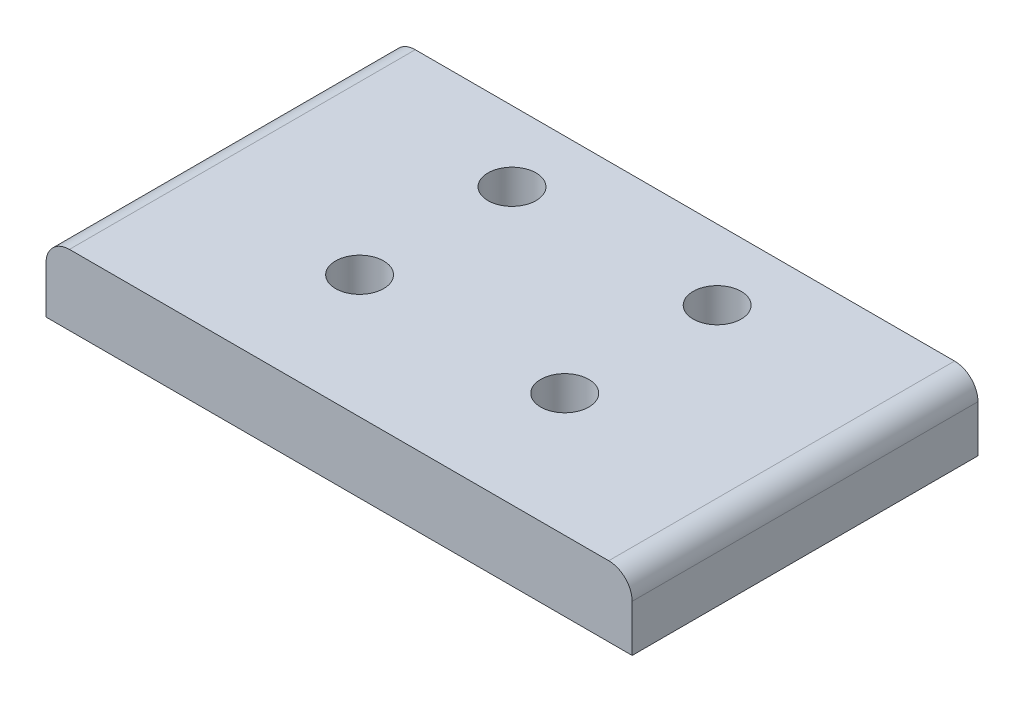
from build123d import *

# Parameters (mm, degrees)
SKETCH1_W             = 17.5
SKETCH1_H             = 6
SKETCH1_H_2           = 13
SKETCH1_W_2           = 16.25
SKETCH1_H_3           = 10.5
BOSS_EXTRUDE1_DEPTH   = 6
FILLET1_R             = 2
FILLET2_R             = 2
F_4_0MM_DOWEL_HOLE2_D = 4.1


with BuildPart() as part:
    # Sketch1 → Boss-Extrude1 (new body)
    with BuildSketch(Plane(origin=(0, 0, 0), x_dir=(1, 0, 0), z_dir=(0, 1, 0))):
        Polygon((0, 0), (16.25, 0), (16.25, 10.5), (16.25, 23.5), (16.25, 29.5), (0, 29.5), align=None)
        with Locations((25, 26.5)):
            Rectangle(SKETCH1_W, SKETCH1_H)
        with Locations((25, 17)):
            Rectangle(SKETCH1_W, SKETCH1_H_2)
        with Locations((41.875, 17)):
            Rectangle(SKETCH1_W_2, SKETCH1_H_2)
        with Locations((25, 5.25)):
            Rectangle(SKETCH1_W, SKETCH1_H_3)
        with Locations((41.875, 5.25)):
            Rectangle(SKETCH1_W_2, SKETCH1_H_3)
        with Locations((41.875, 26.5)):
            Rectangle(SKETCH1_W_2, SKETCH1_H)
    extrude(amount=BOSS_EXTRUDE1_DEPTH)

    # Fillet1
    fillet1_edges = [part.edges().sort_by_distance(p)[0] for p in [
        (0, 6, -14.75),
    ]]
    fillet(fillet1_edges, radius=FILLET1_R)

    # Fillet2
    fillet2_edges = [part.edges().sort_by_distance(p)[0] for p in [
        (50, 6, -14.75),
    ]]
    fillet(fillet2_edges, radius=FILLET2_R)

    # Ø4.0mm Dowel Hole2 (through all)
    with Locations(Plane(origin=(16.25, 0, -23.5), x_dir=(0, 0, -1), z_dir=(0, -1, 0))):
        with Locations((0, 0), (0, 17.5), (-13, 17.5), (-13, 0)):
            Hole(F_4_0MM_DOWEL_HOLE2_D / 2)


solid = part.part
